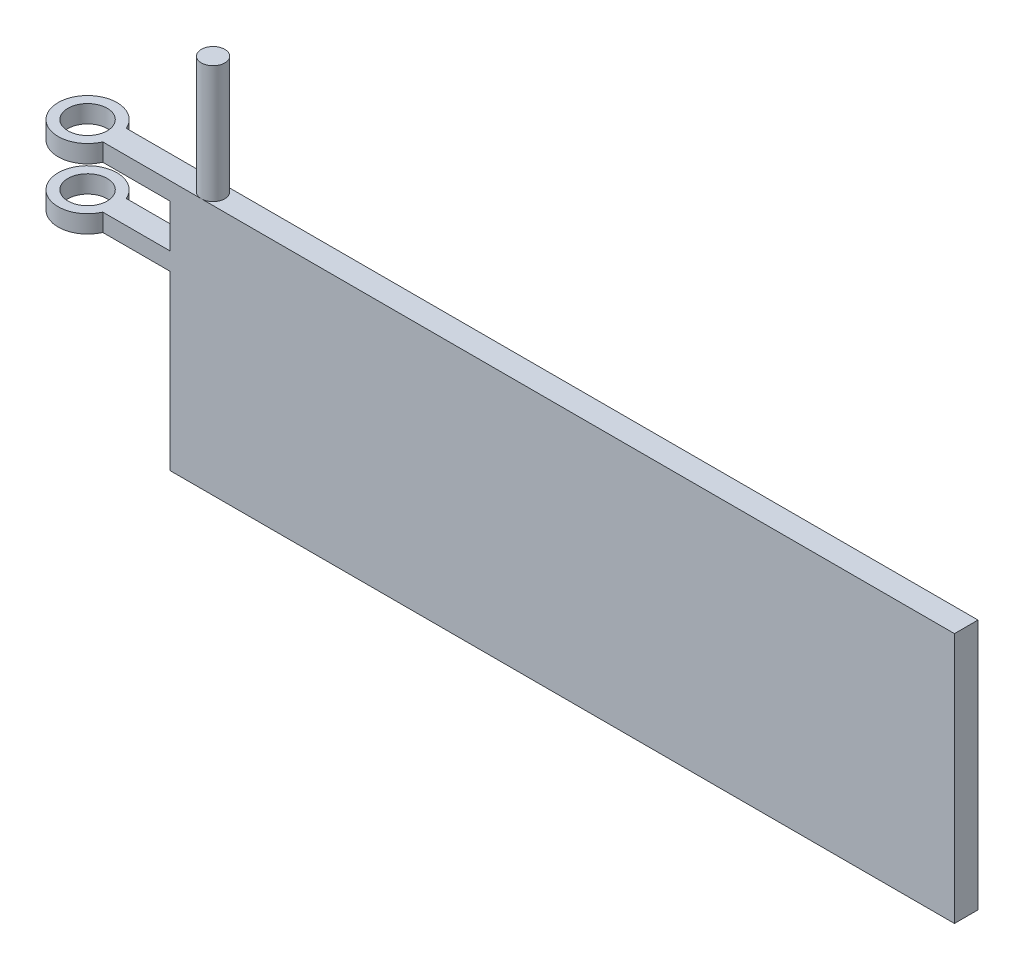
from build123d import *

# Parameters (mm, degrees)
SKETCH2_W               = 100
SKETCH2_H               = 3
BOSS_EXTRUDE1_DEPTH     = 22
SKETCH3_R               = 2.5
BOSS_EXTRUDE2_DEPTH     = 10
SKETCH4_R               = 1.5
BOSS_EXTRUDE3_DEPTH     = 15
CUT_EXTRUDE1_DEPTH      = 81.991511901
CUT_EXTRUDE1_DEPTH_BACK = 81.991511901


with BuildPart() as part:
    # Sketch2 → Boss-Extrude1 (new body)
    with BuildSketch(Plane(origin=(0, 0, 0), x_dir=(1, 0, 0), z_dir=(0, 1, 0))):
        Rectangle(SKETCH2_W, SKETCH2_H)
    extrude(amount=BOSS_EXTRUDE1_DEPTH)

    # Sketch3 → Boss-Extrude2 (add)
    with BuildSketch(Plane(origin=(0, 22, 0), x_dir=(1, 0, 0), z_dir=(0, 1, 0))):
        with BuildLine():
            Line((50, 1.5), (-58.563068229, 1.5))
            ThreePointArc((-58.563068229, 1.5), (-65.75, 0), (-58.563068229, -1.5))
            Line((-58.563068229, -1.5), (50, -1.5))
            Line((50, -1.5), (50, 1.5))
        make_face()
        with Locations(Location((-62, 0, 0), (0, 0, 270))):
            Circle(SKETCH3_R, mode=Mode.SUBTRACT)
    extrude(amount=BOSS_EXTRUDE2_DEPTH)

    # Sketch4 → Boss-Extrude3 (add)
    with BuildSketch(Plane(origin=(0, 32, 0), x_dir=(1, 0, 0), z_dir=(0, 1, 0))):
        with Locations(Location((-46, 0, 0), (0, 0, 270))):
            Circle(SKETCH4_R)
    extrude(amount=BOSS_EXTRUDE3_DEPTH)

    # Sketch5 → Cut-Extrude1 (cut, two sides: drawn at the far end of the back side and taken through both)
    with BuildSketch(Plane.XY.offset(1.5).offset(-CUT_EXTRUDE1_DEPTH_BACK)):
        Polygon((-65.75, 27), (-65.75, 24.25), (-50, 24.25), (-50, 29.75), (-65.75, 29.75), align=None)
    extrude(amount=CUT_EXTRUDE1_DEPTH + CUT_EXTRUDE1_DEPTH_BACK, mode=Mode.SUBTRACT)


solid = part.part
